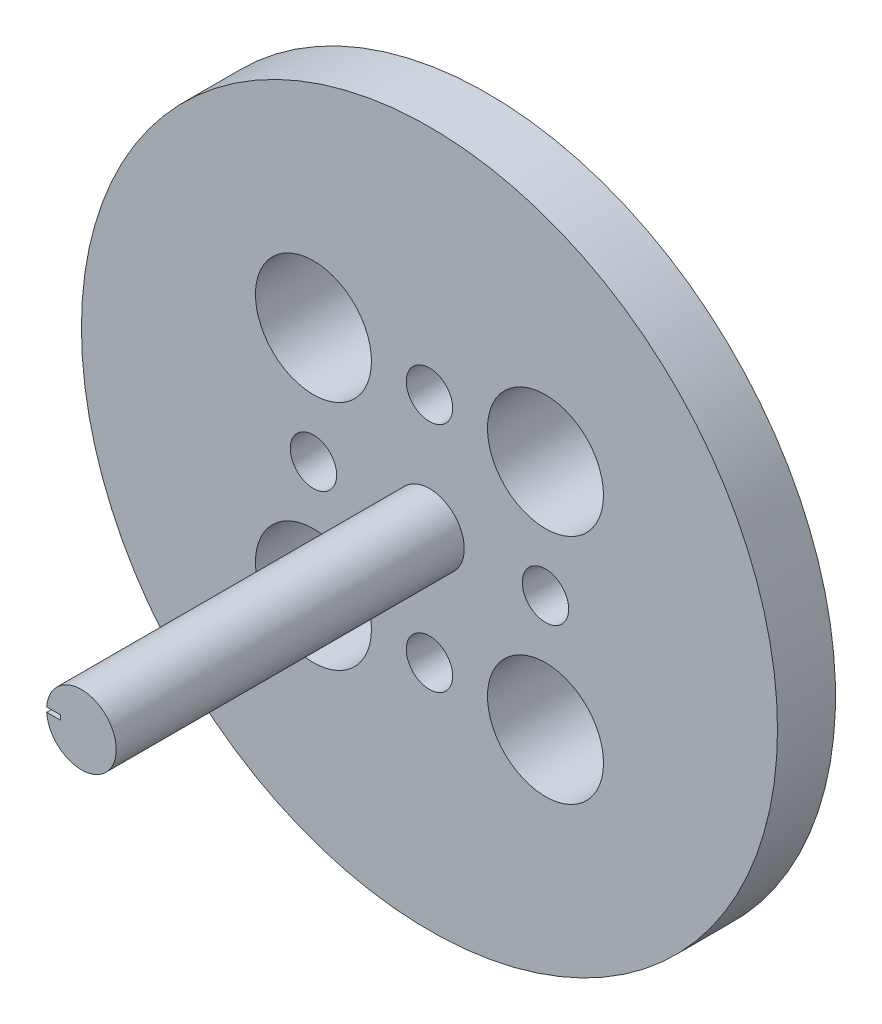
from build123d import *

# Parameters (mm, degrees)
SKETCH1_R              = 15
BODY_DEPTH             = 5
SKETCH2_R              = 15
SKETCH2_R_2            = 10
SLEW_BEARING_LIP_DEPTH = 2.5
SKETCH3_R              = 2.5
CUT_EXTRUDE2_DEPTH     = 22.794494718
BOSS_EXTRUDE1_DEPTH    = 20
SKETCH5_R              = 1
CUT_EXTRUDE3_DEPTH     = 30.154759474


with BuildPart() as part:
    # Sketch1 → body (new body)
    with BuildSketch(Plane.XY):
        Circle(SKETCH1_R)
    extrude(amount=BODY_DEPTH)

    # Sketch2 → slew bearing lip (cut)
    with BuildSketch(Plane(origin=(0, 0, 0), x_dir=(-1, 0, 0), z_dir=(0, 0, -1))):
        Circle(SKETCH2_R)
        Circle(SKETCH2_R_2, mode=Mode.SUBTRACT)
    extrude(amount=-SLEW_BEARING_LIP_DEPTH, mode=Mode.SUBTRACT)

    # Sketch3 → Cut-Extrude2 (cut, through all)
    with BuildSketch(Plane.XY.offset(5)):
        with Locations((-5, 5)):
            Circle(SKETCH3_R)
        with Locations((5, 5)):
            Circle(SKETCH3_R)
        with Locations((5, -5)):
            Circle(SKETCH3_R)
        with Locations((-5, -5)):
            Circle(SKETCH3_R)
    extrude(amount=-CUT_EXTRUDE2_DEPTH, mode=Mode.SUBTRACT)

    # Sketch4 → Boss-Extrude1 (add)
    with BuildSketch(Plane(origin=(0, 0, 0), x_dir=(-1, 0, 0), z_dir=(0, 0, -1))):
        with BuildLine():
            Line((0.90103413, 0.1), (1.496662955, 0.1))
            ThreePointArc((1.496662955, 0.1), (-1.5, 0), (1.496662955, -0.1))
            Line((1.496662955, -0.1), (0.90103413, -0.1))
            Line((0.90103413, -0.1), (0.90103413, 0.1))
        make_face()
    extrude(amount=-BOSS_EXTRUDE1_DEPTH)

    # Sketch5 → Cut-Extrude3 (cut, through all)
    with BuildSketch(Plane(origin=(0, 0, 0), x_dir=(-1, 0, 0), z_dir=(0, 0, -1))):
        with Locations((0, 5)):
            Circle(SKETCH5_R)
        with Locations((5, 0)):
            Circle(SKETCH5_R)
        with Locations((0, -5)):
            Circle(SKETCH5_R)
        with Locations((-5, 0)):
            Circle(SKETCH5_R)
    extrude(amount=-CUT_EXTRUDE3_DEPTH, mode=Mode.SUBTRACT)


solid = part.part
